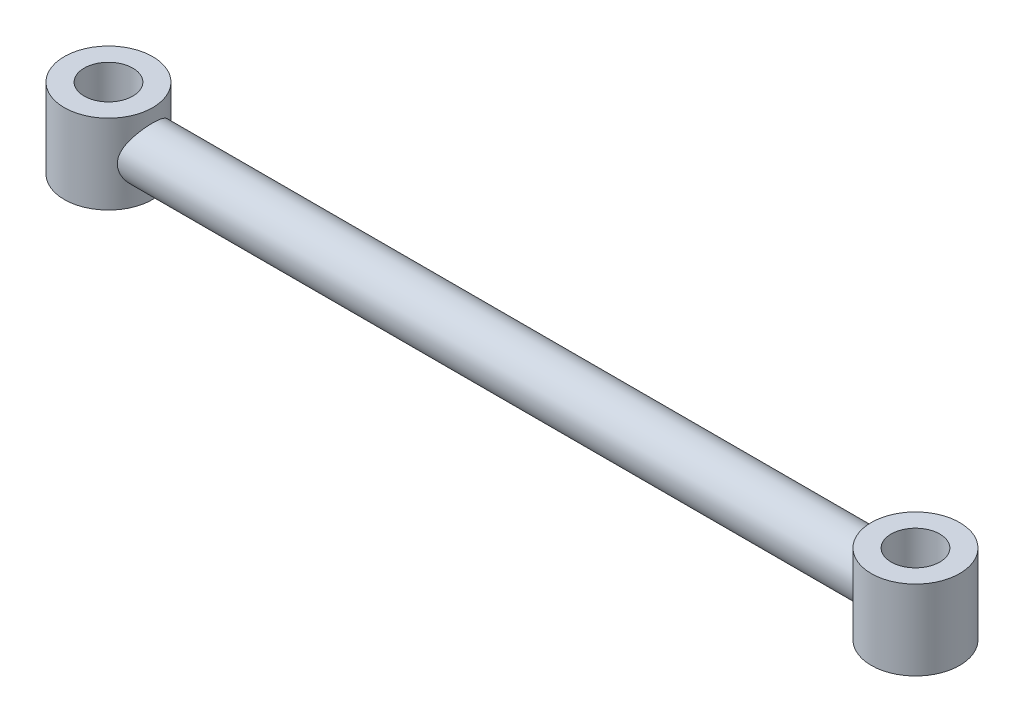
from build123d import *

# Parameters (mm, degrees)
SKETCH5_R           = 12
BOSS_EXTRUDE3_DEPTH = 182.5
SKETCH2_R           = 20
BOSS_EXTRUDE4_DEPTH = 18
SKETCH6_R           = 11
CUT_EXTRUDE1_DEPTH  = 36


with BuildPart() as part:
    # Sketch5 → Boss-Extrude3 (new, symmetric)
    with BuildSketch(Plane(origin=(0, 0, 0), x_dir=(0, 0, -1), z_dir=(1, 0, 0))):
        with Locations(Location((0, 0, 0), (0, 0, 180))):
            Circle(SKETCH5_R)
    extrude(amount=BOSS_EXTRUDE3_DEPTH, both=True)

    # Sketch2 → Boss-Extrude4 (add, symmetric)
    with BuildSketch(Plane(origin=(0, 0, 0), x_dir=(1, 0, 0), z_dir=(0, 1, 0))):
        with Locations(Location((182.5, 0, 0), (0, 0, 270))):
            Circle(SKETCH2_R)
        with Locations(Location((-182.5, 0, 0), (0, 0, 270))):
            Circle(SKETCH2_R)
    extrude(amount=BOSS_EXTRUDE4_DEPTH, both=True)

    # Sketch6 → Cut-Extrude1 (cut)
    with BuildSketch(Plane.XZ.offset(18)):
        with Locations(Location((182.5, 0, 0), (0, 0, 270))):
            Circle(SKETCH6_R)
        with Locations(Location((-182.5, 0, 0), (0, 0, 270))):
            Circle(SKETCH6_R)
    extrude(amount=-CUT_EXTRUDE1_DEPTH, mode=Mode.SUBTRACT)


solid = part.part
